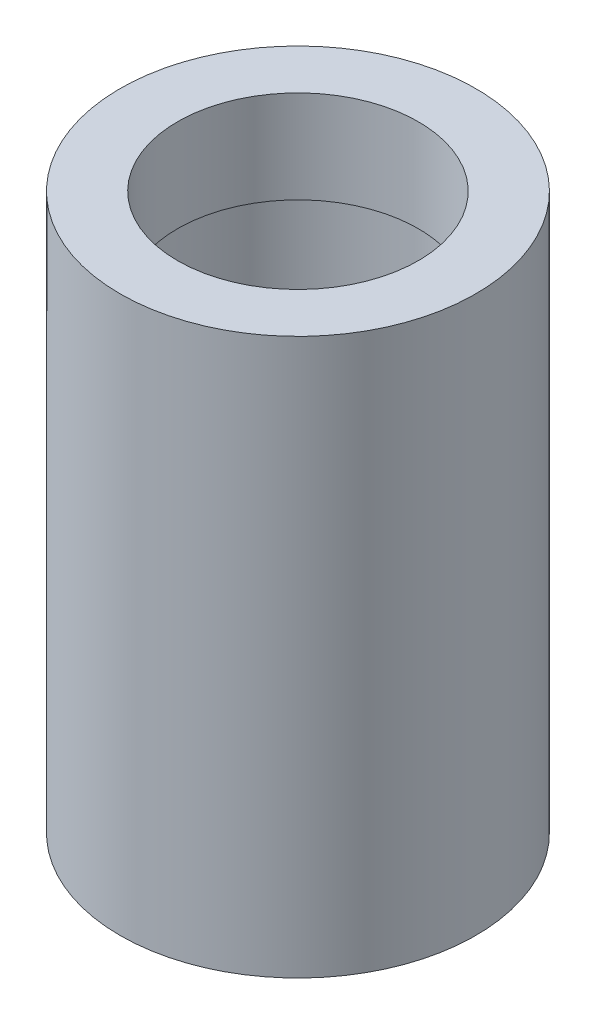
from build123d import *

# Parameters (mm, degrees)
CROQUIS1_R              = 4.8
CROQUIS1_R_2            = 3.5
SALIENTE_EXTRUIR1_DEPTH = 15
CROQUIS2_R              = 3.866185222
CROQUIS2_R_2            = 3.25
SALIENTE_EXTRUIR2_DEPTH = 2.5
REDONDEO1_R             = 0.3


with BuildPart() as part:
    # Croquis1 → Saliente-Extruir1 (new body)
    with BuildSketch(Plane(origin=(0, 0, 0), x_dir=(1, 0, 0), z_dir=(0, 1, 0))):
        with Locations(Location((0, 0, 0), (0, 0, 270))):
            Circle(CROQUIS1_R)
        with Locations(Location((0, 0, 0), (0, 0, 270))):
            Circle(CROQUIS1_R_2, mode=Mode.SUBTRACT)
    extrude(amount=SALIENTE_EXTRUIR1_DEPTH)

    # Croquis2 → Saliente-Extruir2 (add)
    with BuildSketch(Plane(origin=(0, 15, 0), x_dir=(1, 0, 0), z_dir=(0, 1, 0))):
        Circle(CROQUIS2_R)
        with Locations(Location((0, 0, 0), (0, 0, 270))):
            Circle(CROQUIS2_R_2, mode=Mode.SUBTRACT)
    extrude(amount=-SALIENTE_EXTRUIR2_DEPTH)

    # Redondeo1
    redondeo1_edges = [part.edges().sort_by_distance(p)[0] for p in [
        (0, 0, -3.5),
    ]]
    fillet(redondeo1_edges, radius=REDONDEO1_R)


solid = part.part
